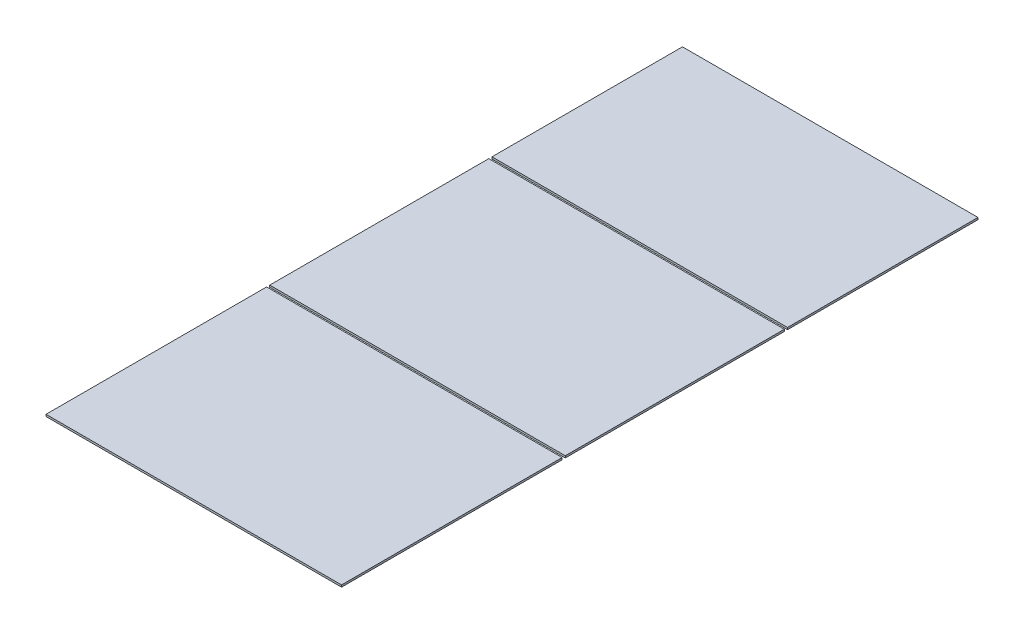
from build123d import *

# Parameters (mm, degrees)
BOSS_EXTRUDE1_DEPTH             = 2.5
BOSS_EXTRUDE1_DEPTH_BACK        = 2.5
SKETCH1_W                       = 736.6
SKETCH1_H                       = 470.568
BOSS_EXTRUDE1_2_DEPTH           = 2.5
BOSS_EXTRUDE1_2_DEPTH_BACK      = 2.5
SKETCH1_H_2                     = 546.768
BOSS_EXTRUDE1_3_DEPTH           = 2.5
BOSS_EXTRUDE1_3_DEPTH_BACK      = 2.5
SKETCH1_H_3                     = 542.864
BOSS_EXTRUDE2_REACH             = 882.801
SKETCH2_W                       = 748.6
SKETCH2_H                       = 482.568
SKETCH2_W_2                     = 736.6
SKETCH2_H_2                     = 470.568
SKETCH2_H_3                     = 558.768
SKETCH2_H_4                     = 546.768
SKETCH2_H_5                     = 554.864
SKETCH2_H_6                     = 542.864
BOSS_EXTRUDE2_DIRECTION_2_REACH = 882.801


with BuildPart() as part:
    # Sketch1 → Boss-Extrude1 (new, two sides: drawn at the far end of the back side and taken through both)
    with BuildSketch(Plane(origin=(0, 0, 0), x_dir=(1, 0, 0), z_dir=(0, 1, 0)).offset(-BOSS_EXTRUDE1_DEPTH_BACK)):
        with Locations((0, 564.816)):
            Rectangle(SKETCH1_W, SKETCH1_H)
    extrude(amount=BOSS_EXTRUDE1_DEPTH + BOSS_EXTRUDE1_DEPTH_BACK)

    # Boss-Extrude2: up to this face of the body (flat: up to its plane)
    boss_extrude2_end = Plane(part.part.faces().sort_by_distance((0, 2.5, -564.816))[0])
    # Sketch2 → Boss-Extrude2 (add, up to the picked face)
    with BuildSketch(Plane(origin=(0, 0, 0), x_dir=(1, 0, 0), z_dir=(0, 1, 0)), mode=Mode.PRIVATE) as boss_extrude2_sk1:
        with Locations((0, 564.816)):
            Rectangle(SKETCH2_W, SKETCH2_H)
        with Locations((0, 564.816)):
            Rectangle(SKETCH2_W_2, SKETCH2_H_2, mode=Mode.SUBTRACT)
    boss_extrude2_tool1 = split(extrude(boss_extrude2_sk1.sketch, amount=BOSS_EXTRUDE2_REACH, mode=Mode.PRIVATE), bisect_by=boss_extrude2_end, keep=Keep.BOTH, mode=Mode.PRIVATE)
    # Sketch2 → Boss-Extrude2 (add, up to the picked face)
    with BuildSketch(Plane(origin=(0, 0, 0), x_dir=(1, 0, 0), z_dir=(0, 1, 0)), mode=Mode.PRIVATE) as boss_extrude2_sk2:
        with Locations((0, -526.716)):
            Rectangle(SKETCH2_W, SKETCH2_H_3)
        with Locations((0, -526.716)):
            Rectangle(SKETCH2_W_2, SKETCH2_H_4, mode=Mode.SUBTRACT)
    boss_extrude2_tool2 = split(extrude(boss_extrude2_sk2.sketch, amount=BOSS_EXTRUDE2_REACH, mode=Mode.PRIVATE), bisect_by=boss_extrude2_end, keep=Keep.BOTH, mode=Mode.PRIVATE)
    # Sketch2 → Boss-Extrude2 (add, up to the picked face)
    with BuildSketch(Plane(origin=(0, 0, 0), x_dir=(1, 0, 0), z_dir=(0, 1, 0)), mode=Mode.PRIVATE) as boss_extrude2_sk3:
        with Locations((0, 38.1)):
            Rectangle(SKETCH2_W, SKETCH2_H_5)
        with Locations((0, 38.1)):
            Rectangle(SKETCH2_W_2, SKETCH2_H_6, mode=Mode.SUBTRACT)
    boss_extrude2_tool3 = split(extrude(boss_extrude2_sk3.sketch, amount=BOSS_EXTRUDE2_REACH, mode=Mode.PRIVATE), bisect_by=boss_extrude2_end, keep=Keep.BOTH, mode=Mode.PRIVATE)


with BuildPart() as body_2:
    # Sketch1 → Boss-Extrude1 2 (new, two sides: drawn at the far end of the back side and taken through both)
    with BuildSketch(Plane(origin=(0, 0, 0), x_dir=(1, 0, 0), z_dir=(0, 1, 0)).offset(-BOSS_EXTRUDE1_2_DEPTH_BACK)):
        with Locations((0, -526.716)):
            Rectangle(SKETCH1_W, SKETCH1_H_2)
    extrude(amount=BOSS_EXTRUDE1_2_DEPTH + BOSS_EXTRUDE1_2_DEPTH_BACK)


with BuildPart() as body_3:
    # Sketch1 → Boss-Extrude1 3 (new, two sides: drawn at the far end of the back side and taken through both)
    with BuildSketch(Plane(origin=(0, 0, 0), x_dir=(1, 0, 0), z_dir=(0, 1, 0)).offset(-BOSS_EXTRUDE1_3_DEPTH_BACK)):
        with Locations((0, 38.1)):
            Rectangle(SKETCH1_W, SKETCH1_H_3)
    extrude(amount=BOSS_EXTRUDE1_3_DEPTH + BOSS_EXTRUDE1_3_DEPTH_BACK)


with BuildPart() as part_1:
    add(part.part)

    add(body_2.part)  # Boss-Extrude2 merges body 2

    add(body_3.part)  # Boss-Extrude2 merges body 3
    add(boss_extrude2_tool1.solids().sort_by(Axis((0, 0, -805.209341), (0, 1, 0)))[0])
    add(boss_extrude2_tool2.solids().sort_by(Axis((0, 0, 805.165857), (0, 1, 0)))[0])
    add(boss_extrude2_tool3.solids().sort_by(Axis((0, 0, -314.600187), (0, 1, 0)))[0])

    # Boss-Extrude2 direction 2: up to this face of the body (flat: up to its plane)
    boss_extrude2_direction_2_end = Plane(part_1.part.faces().sort_by_distance((0, -2.5, -564.816))[0])
    # Sketch2 → Boss-Extrude2 direction 2 (add, up to the picked face)
    with BuildSketch(Plane(origin=(0, 0, 0), x_dir=(1, 0, 0), z_dir=(0, 1, 0)), mode=Mode.PRIVATE) as boss_extrude2_direction_2_sk1:
        with Locations((0, 564.816)):
            Rectangle(SKETCH2_W, SKETCH2_H)
        with Locations((0, 564.816)):
            Rectangle(SKETCH2_W_2, SKETCH2_H_2, mode=Mode.SUBTRACT)
    boss_extrude2_direction_2_tool1 = split(extrude(boss_extrude2_direction_2_sk1.sketch, amount=-BOSS_EXTRUDE2_DIRECTION_2_REACH, mode=Mode.PRIVATE), bisect_by=boss_extrude2_direction_2_end, keep=Keep.BOTH, mode=Mode.PRIVATE)
    # Sketch2 → Boss-Extrude2 direction 2 (add, up to the picked face)
    with BuildSketch(Plane(origin=(0, 0, 0), x_dir=(1, 0, 0), z_dir=(0, 1, 0)), mode=Mode.PRIVATE) as boss_extrude2_direction_2_sk2:
        with Locations((0, -526.716)):
            Rectangle(SKETCH2_W, SKETCH2_H_3)
        with Locations((0, -526.716)):
            Rectangle(SKETCH2_W_2, SKETCH2_H_4, mode=Mode.SUBTRACT)
    boss_extrude2_direction_2_tool2 = split(extrude(boss_extrude2_direction_2_sk2.sketch, amount=-BOSS_EXTRUDE2_DIRECTION_2_REACH, mode=Mode.PRIVATE), bisect_by=boss_extrude2_direction_2_end, keep=Keep.BOTH, mode=Mode.PRIVATE)
    # Sketch2 → Boss-Extrude2 direction 2 (add, up to the picked face)
    with BuildSketch(Plane(origin=(0, 0, 0), x_dir=(1, 0, 0), z_dir=(0, 1, 0)), mode=Mode.PRIVATE) as boss_extrude2_direction_2_sk3:
        with Locations((0, 38.1)):
            Rectangle(SKETCH2_W, SKETCH2_H_5)
        with Locations((0, 38.1)):
            Rectangle(SKETCH2_W_2, SKETCH2_H_6, mode=Mode.SUBTRACT)
    boss_extrude2_direction_2_tool3 = split(extrude(boss_extrude2_direction_2_sk3.sketch, amount=-BOSS_EXTRUDE2_DIRECTION_2_REACH, mode=Mode.PRIVATE), bisect_by=boss_extrude2_direction_2_end, keep=Keep.BOTH, mode=Mode.PRIVATE)
    add(boss_extrude2_direction_2_tool1.solids().sort_by(Axis((0, 0, -805.209341), (0, -1, 0)))[0])
    add(boss_extrude2_direction_2_tool2.solids().sort_by(Axis((0, 0, 805.165857), (0, -1, 0)))[0])
    add(boss_extrude2_direction_2_tool3.solids().sort_by(Axis((0, 0, -314.600187), (0, -1, 0)))[0])


solid = part_1.part
